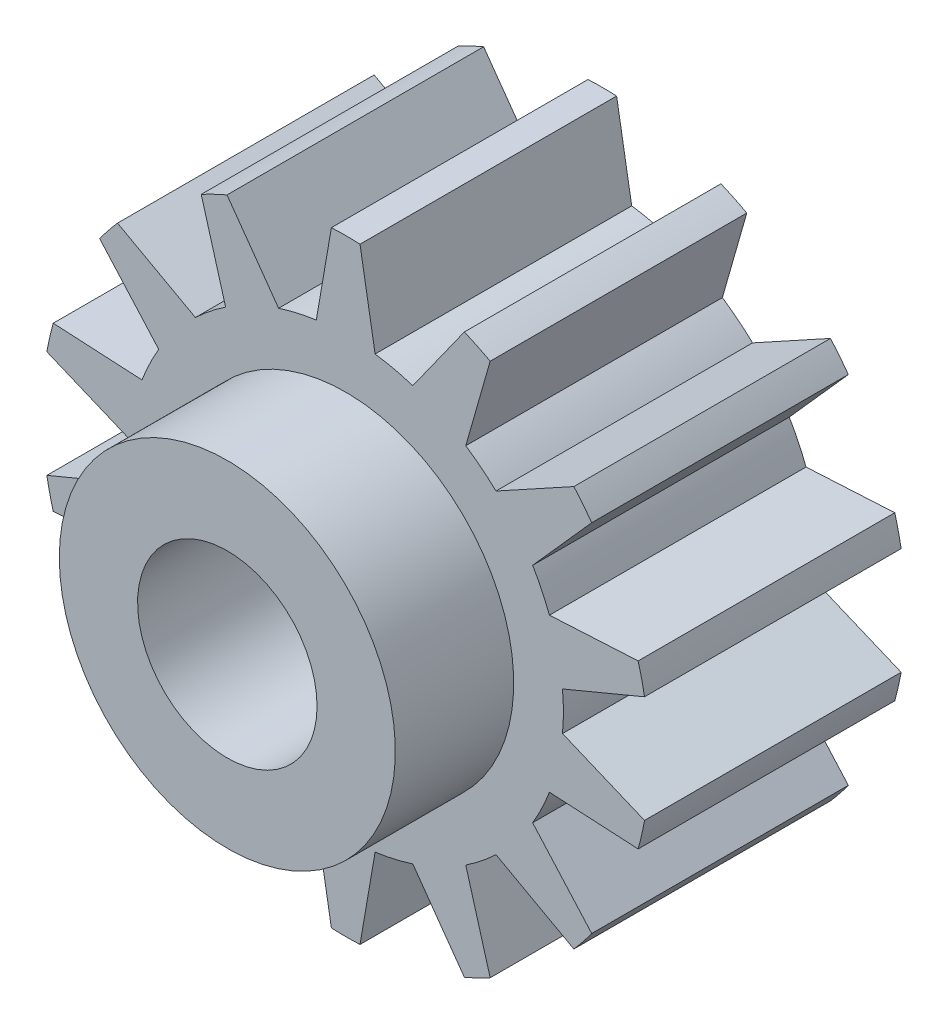
from build123d import *

# Parameters (mm, degrees)
SKETCH1_R              = 5.7
MOTOR_GEAR_SHAPE_DEPTH = 6.72
MOTOR_START            = -6.72
MOTOR_GEAR_TOOTH_DEPTH = 6.72
MOTOR_GEAR_TEETH_COUNT = 14
MOTOR_GEAR_TEETH_ANGLE = 334.28577
SKETCH3_R              = 4.4
SKETCH3_R_2            = 2.35
MOTOR_GEAR_BOSS_DEPTH  = 3.1
SKETCH4_R              = 2.35
MOTOR_SHAFT_HOLE_DEPTH = 15.861806289
MOTOR_SHAFT_FLAT_DEPTH = 4.9


with BuildPart() as part:
    # Sketch1 → motor gear shape (new body)
    with BuildSketch(Plane.XY):
        Circle(SKETCH1_R)
    extrude(amount=MOTOR_GEAR_SHAPE_DEPTH)

    # Sketch2 → motor gear tooth (add)
    with BuildSketch(Plane.XY.offset(6.72).offset(MOTOR_START)):
        with BuildLine():
            Line((0.375, 7.941150735), (0.77, 5.647751765))
            ThreePointArc((0.77, 5.647751765), (0, 5.7), (-0.77, 5.647751765))
            Line((-0.77, 5.647751765), (-0.375, 7.941150735))
            ThreePointArc((-0.375, 7.941150735), (0, 7.95), (0.375, 7.941150735))
        make_face()
    motor_gear_tooth = extrude(amount=MOTOR_GEAR_TOOTH_DEPTH)

    # motor gear teeth: motor gear tooth ×14 about axis
    motor_gear_teeth_axis = Axis((0, 0, 0), (0, 0, -1))
    for i in range(1, MOTOR_GEAR_TEETH_COUNT):
        add(motor_gear_tooth.rotate(motor_gear_teeth_axis, i * MOTOR_GEAR_TEETH_ANGLE / (MOTOR_GEAR_TEETH_COUNT - 1)))

    # Sketch3 → motor gear boss (add)
    with BuildSketch(Plane.XY.offset(6.72)):
        with Locations(Location((0, 0, 0), (0, 0, 180))):
            Circle(SKETCH3_R)
        with Locations(Location((0, 0, 0), (0, 0, 180))):
            Circle(SKETCH3_R_2, mode=Mode.SUBTRACT)
    extrude(amount=MOTOR_GEAR_BOSS_DEPTH)

    # Sketch4 → motor shaft hole (cut, through all)
    with BuildSketch(Plane.XY.offset(9.82)):
        with Locations(Location((0, 0, 0), (0, 0, 180))):
            Circle(SKETCH4_R)
    extrude(amount=-MOTOR_SHAFT_HOLE_DEPTH, mode=Mode.SUBTRACT)

    # Sketch5 → motor shaft flat (add)
    with BuildSketch(Plane(origin=(0, 0, 0), x_dir=(-1, 0, 0), z_dir=(0, 0, -1))):
        with BuildLine():
            Line((-3.108054054, -1.25), (3.108054054, -1.25))
            ThreePointArc((3.108054054, -1.25), (0, -3.35), (-3.108054054, -1.25))
        make_face()
    extrude(amount=-MOTOR_SHAFT_FLAT_DEPTH)


solid = part.part
